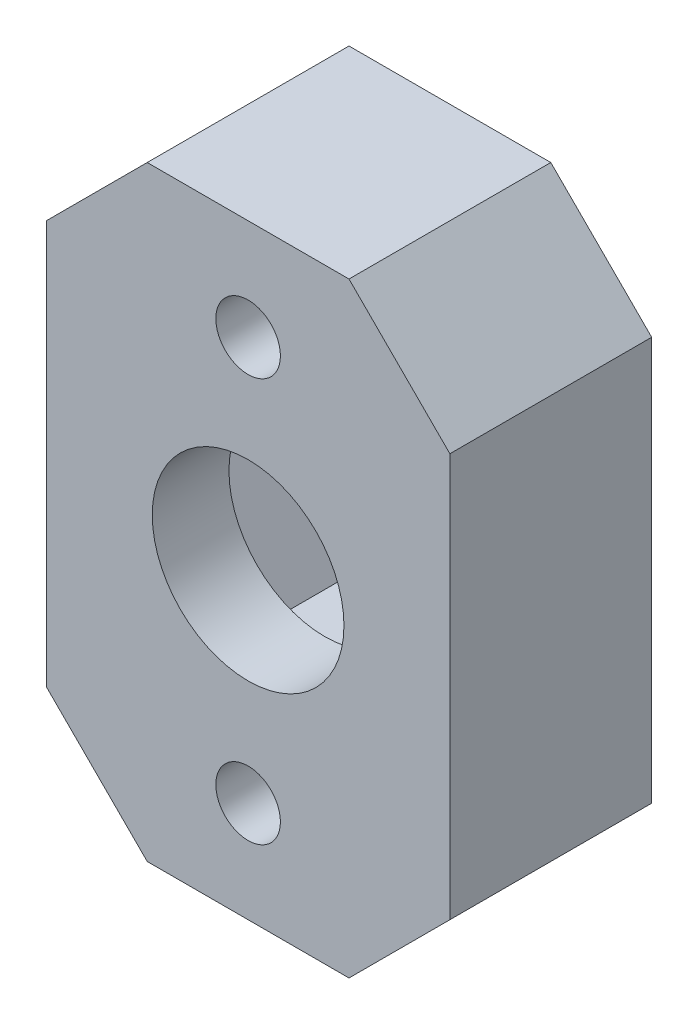
from build123d import *

# Parameters (mm, degrees)
SKETCH_1_W      = 20
SKETCH_1_H      = 30
SKETCH_1_R      = 1.6
EXTRUDE_1_DEPTH = 10
CHAMFER_1_SIZE  = 5
SKETCH_2_W      = 15
SKETCH_2_H      = 15
SKETCH_2_R      = 4.75
EXTRUDE_2_DEPTH = 3.8


with BuildPart() as part:
    # 草圖1 → 填料-伸長1 (new body)
    with BuildSketch(Plane.XY):
        Rectangle(SKETCH_1_W, SKETCH_1_H)
        with Locations((0, 10)):
            Circle(SKETCH_1_R, mode=Mode.SUBTRACT)
        with Locations((0, -10)):
            Circle(SKETCH_1_R, mode=Mode.SUBTRACT)
        Polygon((7.447818473, 0), (3.723909236, 6.45), (-3.723909236, 6.45), (-7.447818473, 0), (-3.723909236, -6.45), (3.723909236, -6.45), align=None, mode=Mode.SUBTRACT)
    extrude(amount=EXTRUDE_1_DEPTH)

    # 導角1
    chamfer_1_edges = [part.edges().sort_by_distance(p)[0] for p in [
        (10, -15, 5),
        (-10, -15, 5),
        (-10, 15, 5),
        (10, 15, 5),
    ]]
    chamfer(chamfer_1_edges, length=CHAMFER_1_SIZE)

    # 草圖2 → 填料-伸長2 (add)
    with BuildSketch(Plane.XY.offset(10)):
        Rectangle(SKETCH_2_W, SKETCH_2_H)
        Circle(SKETCH_2_R, mode=Mode.SUBTRACT)
    extrude(amount=-EXTRUDE_2_DEPTH)


solid = part.part
